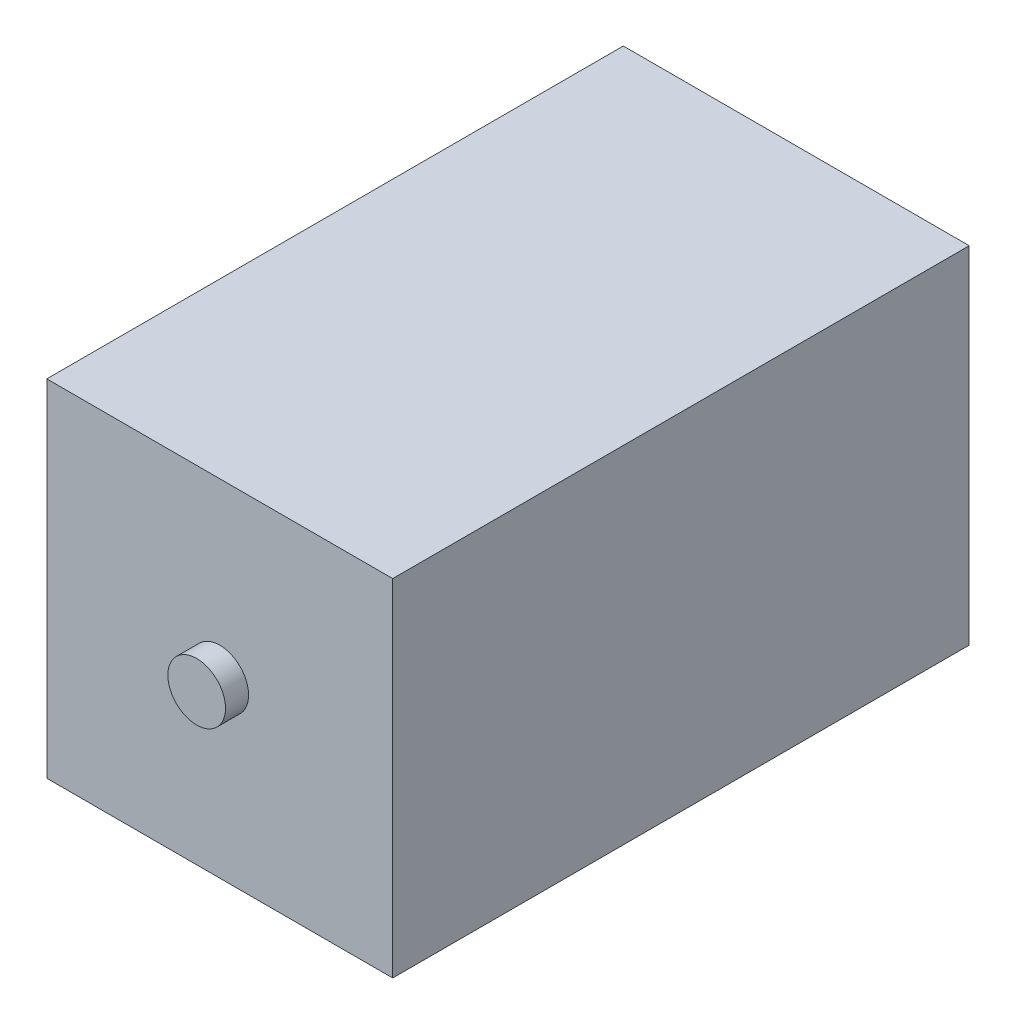
from build123d import *

# Parameters (mm, degrees)
SKETCH1_W           = 150
SKETCH1_H           = 150
BOSS_EXTRUDE1_DEPTH = 250
SKETCH2_R           = 12.5
BOSS_EXTRUDE2_DEPTH = 10


with BuildPart() as part:
    # Sketch1 → Boss-Extrude1 (new body)
    with BuildSketch(Plane.XY):
        with Locations((75, 75)):
            Rectangle(SKETCH1_W, SKETCH1_H)
    extrude(amount=BOSS_EXTRUDE1_DEPTH)

    # Sketch2 → Boss-Extrude2 (add)
    with BuildSketch(Plane.XY.offset(250)):
        with Locations((75, 75)):
            Circle(SKETCH2_R)
    extrude(amount=BOSS_EXTRUDE2_DEPTH)


solid = part.part
